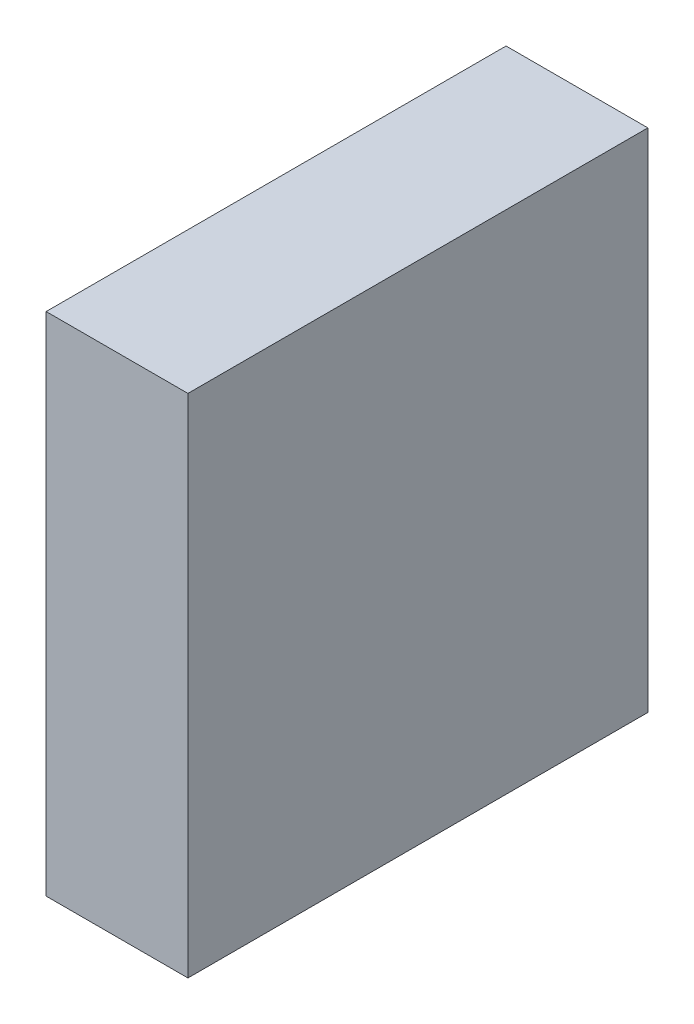
from build123d import *

# Parameters (mm, degrees)
SKETCH2_W           = 19.812
SKETCH2_H           = 64.262
BOSS_EXTRUDE1_DEPTH = 70.739


with BuildPart() as part:
    # Sketch2 → Boss-Extrude1 (new body)
    with BuildSketch(Plane(origin=(0, 0, 0), x_dir=(1, 0, 0), z_dir=(0, 1, 0))):
        with Locations((9.906, 32.131)):
            Rectangle(SKETCH2_W, SKETCH2_H)
    extrude(amount=BOSS_EXTRUDE1_DEPTH)


solid = part.part
